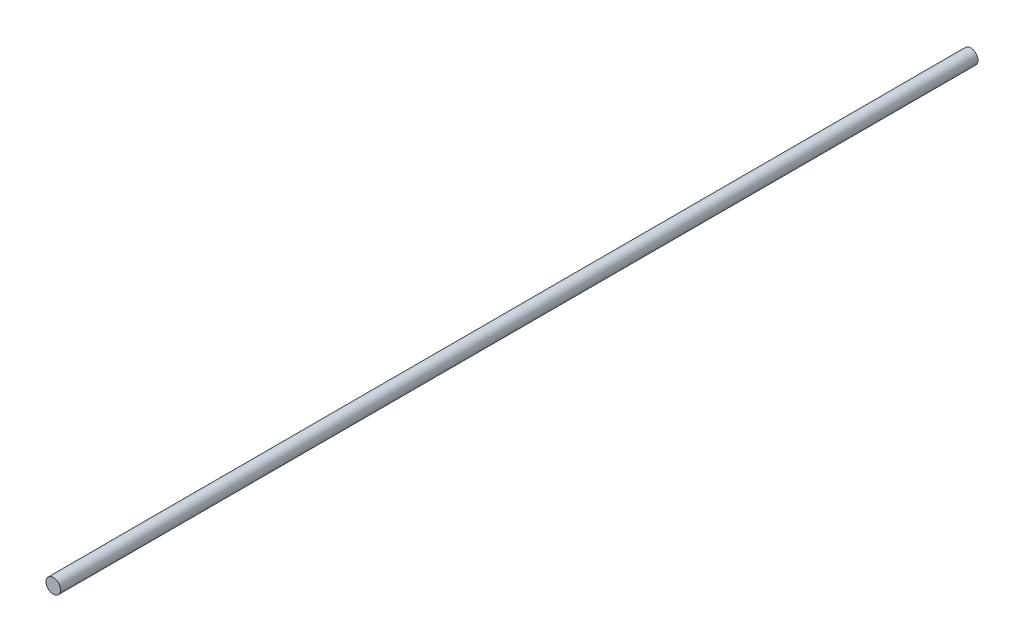
from build123d import *

# Parameters (mm, degrees)
SKETCH_1_R      = 3
EXTRUDE_1_DEPTH = 380


with BuildPart() as part:
    # 草图1 → 凸台-拉伸1 (new body)
    with BuildSketch(Plane.XY):
        Circle(SKETCH_1_R)
    extrude(amount=EXTRUDE_1_DEPTH)


solid = part.part
